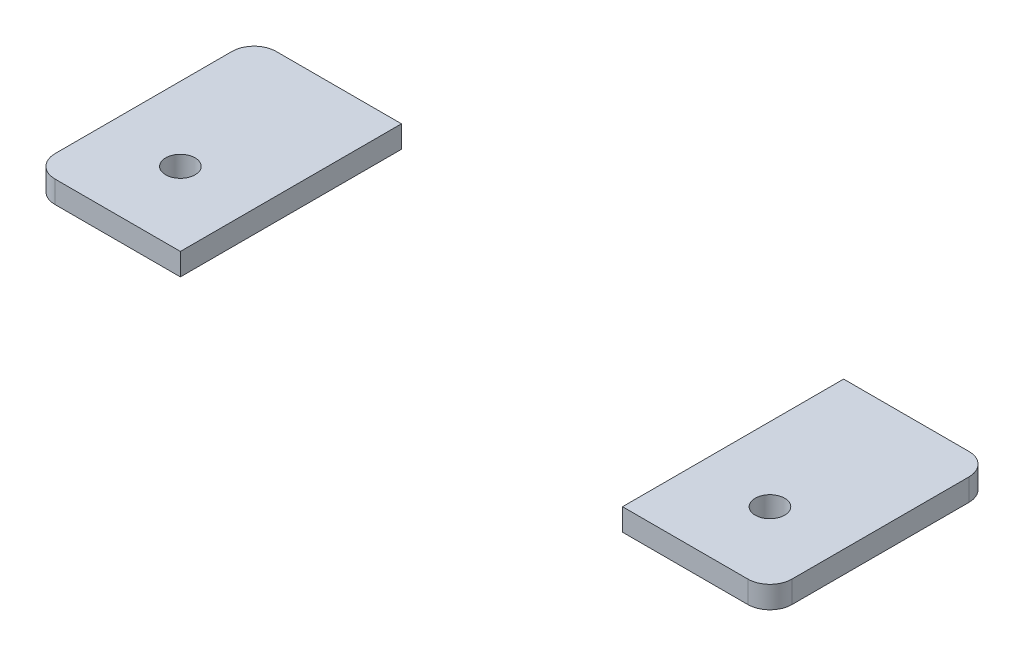
from build123d import *

# Parameters (mm, degrees)
SKETCH_1_R        = 2
EXTRUDE_2_DEPTH   = 3
EXTRUDE_2_2_DEPTH = 3


with BuildPart() as part:
    # 草图1 → 凸台-拉伸2 (new body)
    with BuildSketch(Plane(origin=(0, 0, 0), x_dir=(1, 0, 0), z_dir=(0, 1, 0))):
        with BuildLine():
            Line((-30, 15), (-30, -15))
            Line((-30, -15), (-47, -15))
            ThreePointArc((-47, -15), (-49.121320344, -14.121320344), (-50, -12))
            Line((-50, -12), (-50, 12))
            ThreePointArc((-50, 12), (-49.121320344, 14.121320344), (-47, 15))
            Line((-47, 15), (-30, 15))
        make_face()
        with Locations(Location((-40, -5, 0), (0, 0, 270))):
            Circle(SKETCH_1_R, mode=Mode.SUBTRACT)
    extrude(amount=EXTRUDE_2_DEPTH)


with BuildPart() as body_2:
    # 草图1 → Extrude 2 2 (new body)
    with BuildSketch(Plane(origin=(0, 0, 0), x_dir=(1, 0, 0), z_dir=(0, 1, 0))):
        with BuildLine():
            Line((50, -12), (50, 12))
            ThreePointArc((50, 12), (49.121320344, 14.121320344), (47, 15))
            Line((47, 15), (30, 15))
            Line((30, 15), (30, -15))
            Line((30, -15), (47, -15))
            ThreePointArc((47, -15), (49.121320344, -14.121320344), (50, -12))
        make_face()
        with Locations(Location((40, -5, 0), (0, 0, 270))):
            Circle(SKETCH_1_R, mode=Mode.SUBTRACT)
    extrude(amount=EXTRUDE_2_2_DEPTH)


solid = Compound([part.part, body_2.part])
